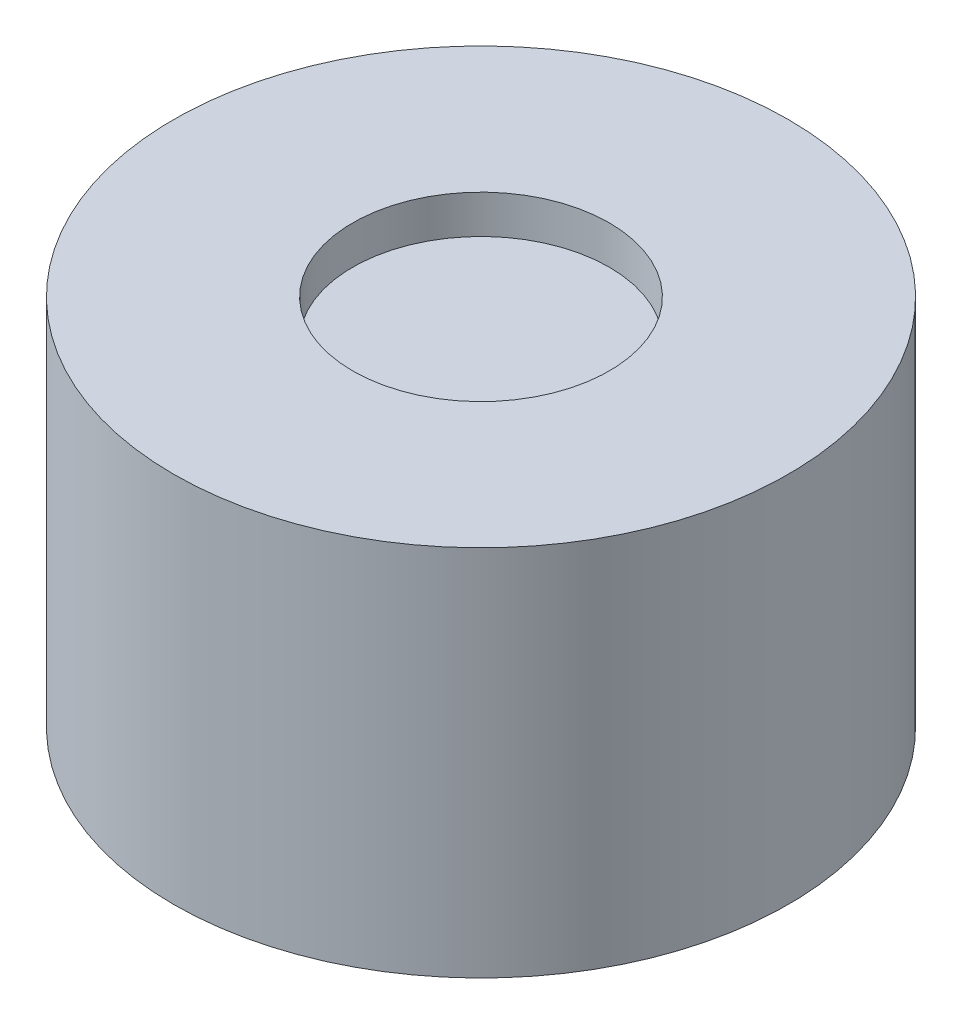
from build123d import *

# Parameters (mm, degrees)
CROQUIS1_R              = 40
SALIENTE_EXTRUIR1_DEPTH = 48.5
CROQUIS2_R              = 16.7
CORTAR_EXTRUIR1_DEPTH   = 5


with BuildPart() as part:
    # Croquis1 → Saliente-Extruir1 (new body)
    with BuildSketch(Plane(origin=(0, 0, 0), x_dir=(1, 0, 0), z_dir=(0, 1, 0))):
        with Locations(Location((0, 0, 0), (0, 0, 90))):
            Circle(CROQUIS1_R)
    extrude(amount=SALIENTE_EXTRUIR1_DEPTH)

    # Croquis2 → Cortar-Extruir1 (cut)
    with BuildSketch(Plane(origin=(0, 48.5, 0), x_dir=(1, 0, 0), z_dir=(0, 1, 0))):
        with Locations(Location((0, 0, 0), (0, 0, 270))):
            Circle(CROQUIS2_R)
    extrude(amount=-CORTAR_EXTRUIR1_DEPTH, mode=Mode.SUBTRACT)


solid = part.part
